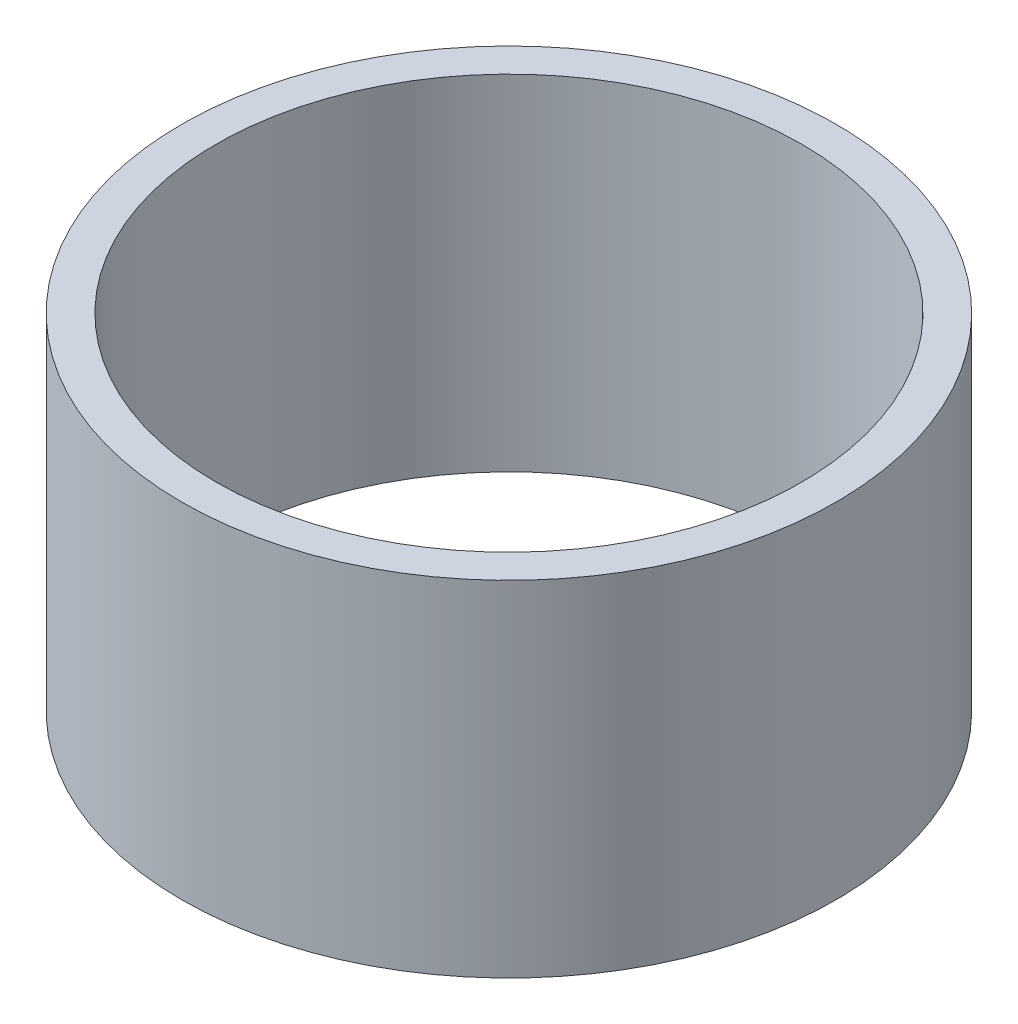
from build123d import *

# Parameters (mm, degrees)
SKETCH1_R           = 48.26
BOSS_EXTRUDE1_DEPTH = 50.8
SKETCH2_R           = 43.18
CUT_EXTRUDE1_DEPTH  = 50.8


with BuildPart() as part:
    # Sketch1 → Boss-Extrude1 (new body)
    with BuildSketch(Plane(origin=(0, 0, 0), x_dir=(1, 0, 0), z_dir=(0, 1, 0))):
        with Locations(Location((0, 0, 0), (0, 0, 270))):
            Circle(SKETCH1_R)
    extrude(amount=BOSS_EXTRUDE1_DEPTH)

    # Sketch2 → Cut-Extrude1 (cut)
    with BuildSketch(Plane(origin=(0, 50.8, 0), x_dir=(1, 0, 0), z_dir=(0, 1, 0))):
        with Locations(Location((0, 0, 0), (0, 0, 270))):
            Circle(SKETCH2_R)
    extrude(amount=-CUT_EXTRUDE1_DEPTH, mode=Mode.SUBTRACT)


solid = part.part
